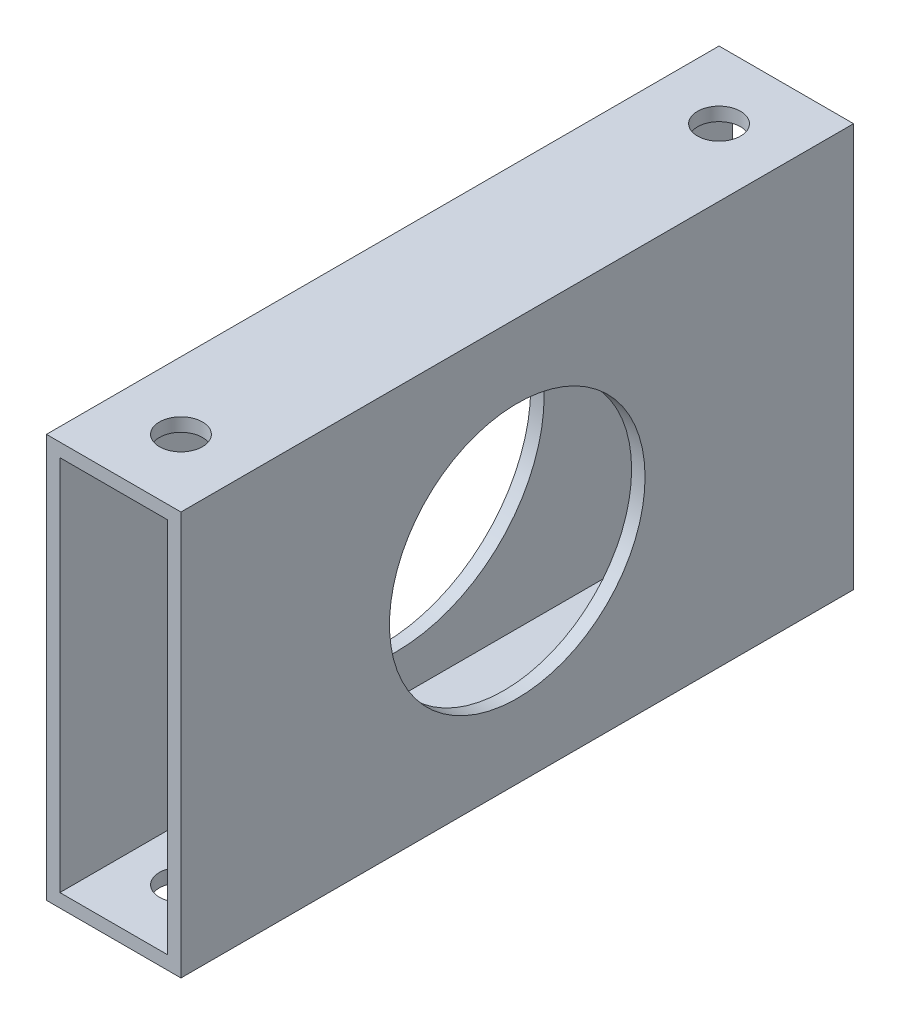
from build123d import *

# Parameters (mm, degrees)
SKETCH_289_W           = 10
SKETCH_289_H           = 30
SKETCH_289_W_2         = 8
SKETCH_289_H_2         = 28
EXTRUDE_359_DEPTH      = 50
SKETCH_433_R           = 1.6
CUT_EXTRUDE_966_DEPTH  = 59.523499554
SKETCH_661_R           = 9.5
CUT_EXTRUDE_1010_DEPTH = 54.150729064
CUT_EXTRUDE_1_REACH    = 55.151
SKETCH_1_R             = 11


with BuildPart() as part:
    # Sketch 289 → Extrude 359 (new body)
    with BuildSketch(Plane.XY):
        Rectangle(SKETCH_289_W, SKETCH_289_H)
        Rectangle(SKETCH_289_W_2, SKETCH_289_H_2, mode=Mode.SUBTRACT)
    extrude(amount=EXTRUDE_359_DEPTH)

    # Sketch 433 → Cut-Extrude 966 (cut, through all)
    with BuildSketch(Plane(origin=(0, 15, 0), x_dir=(1, 0, 0), z_dir=(0, 1, 0))):
        with Locations(Location((0, -5, 0), (0, 0, 270))):
            Circle(SKETCH_433_R)
        with Locations(Location((0, -45, 0), (0, 0, 270))):
            Circle(SKETCH_433_R)
    extrude(amount=-CUT_EXTRUDE_966_DEPTH, mode=Mode.SUBTRACT)

    # Sketch 661 → Cut-Extrude 1010 (cut, through all)
    with BuildSketch(Plane(origin=(5, 0, 0), x_dir=(0, 0, -1), z_dir=(1, 0, 0))):
        with Locations((-25, 0)):
            Circle(SKETCH_661_R)
    extrude(amount=-CUT_EXTRUDE_1010_DEPTH, mode=Mode.SUBTRACT)

    # ｽｹｯﾁ1 → ｶｯﾄ - 押し出し1 (cut, up to next)
    with BuildSketch(Plane.ZY.offset(5), mode=Mode.PRIVATE) as cut_extrude_1_sk1:
        with Locations((25, 0)):
            Circle(SKETCH_1_R)
    cut_extrude_1_tool1 = extrude(cut_extrude_1_sk1.sketch, amount=-CUT_EXTRUDE_1_REACH, mode=Mode.PRIVATE) & part.part
    add(cut_extrude_1_tool1.solids().sort_by_distance((-5, 0, 25))[0], mode=Mode.SUBTRACT)


solid = part.part
